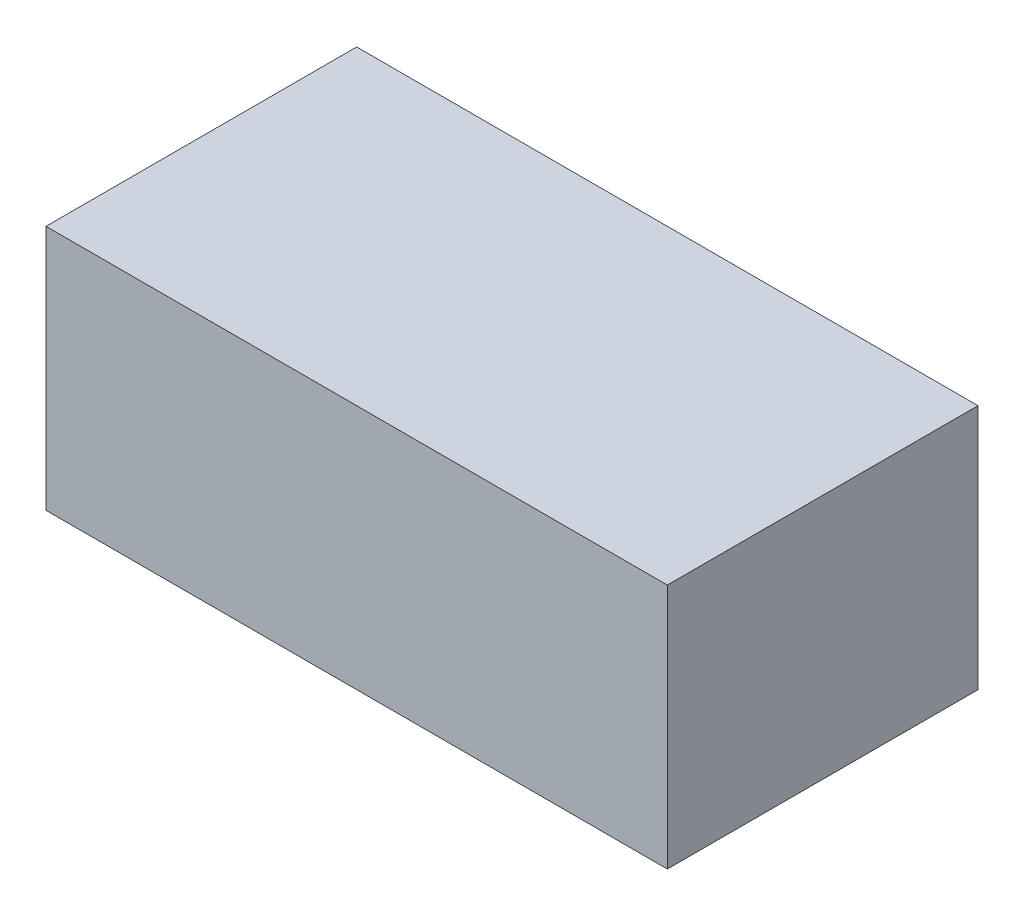
from build123d import *

# Parameters (mm, degrees)
SKETCH1_W           = 4.8
SKETCH1_H           = 2.4
BOSS_EXTRUDE1_DEPTH = 1.9


with BuildPart() as part:
    # Sketch1 → Boss-Extrude1 (new body)
    with BuildSketch(Plane(origin=(0, 0, 0), x_dir=(1, 0, 0), z_dir=(0, 1, 0))):
        with Locations((2.4, 1.2)):
            Rectangle(SKETCH1_W, SKETCH1_H)
    extrude(amount=BOSS_EXTRUDE1_DEPTH)


solid = part.part
